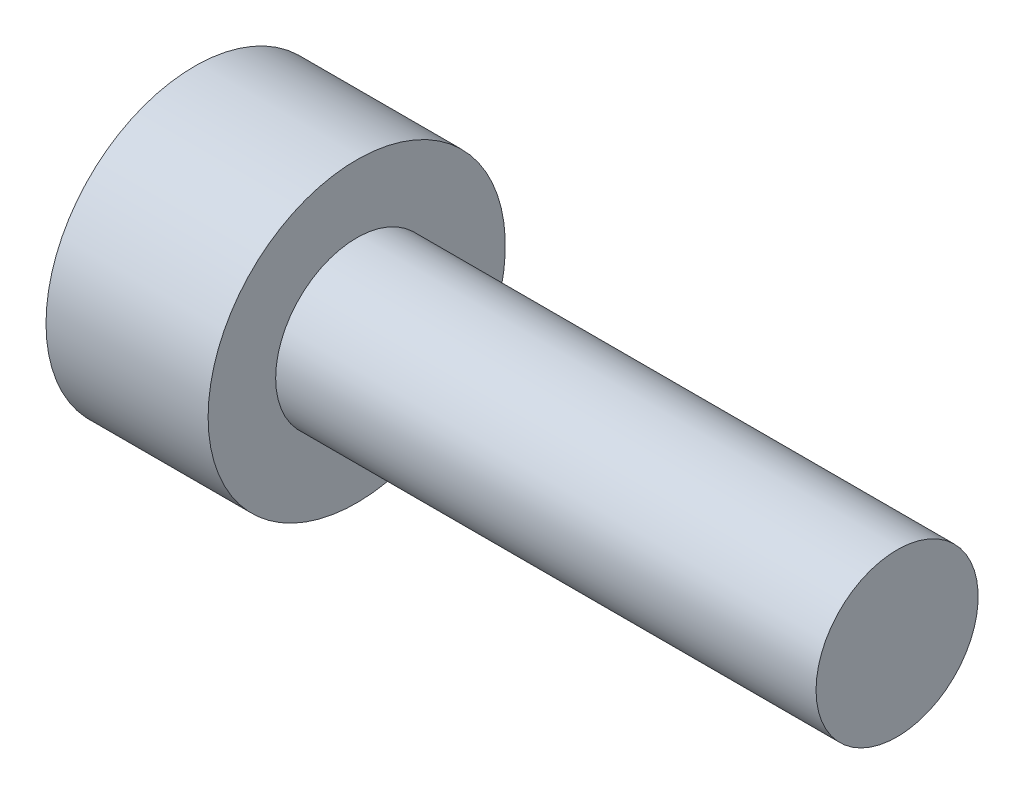
from build123d import *

# Parameters (mm, degrees)
SOCKET_DEPTH = 1.5


with BuildPart() as part:
    # Screw Sketch → Screw (revolve)
    with BuildSketch(Plane.XY):
        Polygon((-3, 0), (-3, 2.75), (0, 2.75), (0, 1.5), (10, 1.5), (10, 0), align=None)
    revolve(axis=Axis((-1000, 0, 0), (1, 0, 0)))

    # Socket Sketch → Socket (cut)
    with BuildSketch(Plane(origin=(-3, 0, 0), x_dir=(0, 0, -1), z_dir=(1, 0, 0))):
        Polygon((1.443375673, 0), (0.721687836, 1.25), (-0.721687836, 1.25), (-1.443375673, 0), (-0.721687836, -1.25), (0.721687836, -1.25), align=None)
    extrude(amount=SOCKET_DEPTH, mode=Mode.SUBTRACT)


solid = part.part
